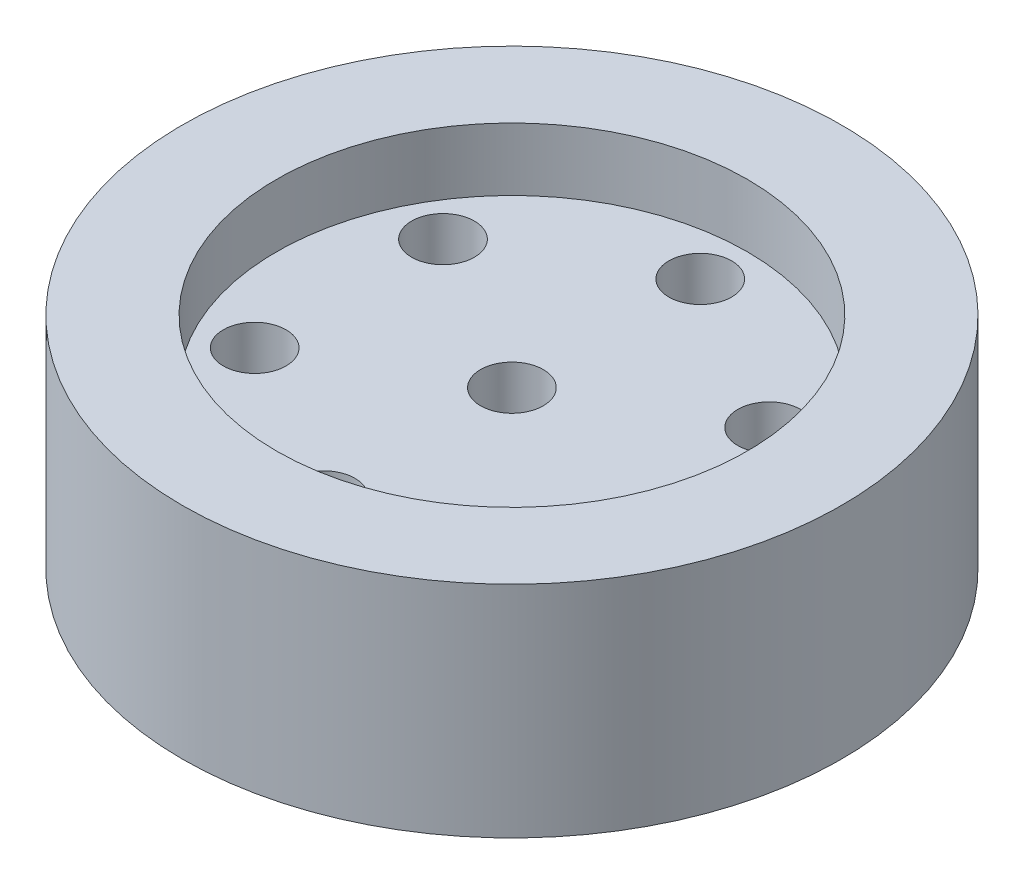
from build123d import *

# Parameters (mm, degrees)
SKETCH1_R               = 21
BOSS_EXTRUDE1_DEPTH     = 7
SKETCH2_R               = 15
CUT_EXTRUDE1_DEPTH      = 4
SKETCH3_R               = 19
SKETCH3_R_2             = 5
CUT_EXTRUDE2_DEPTH      = 4
SKETCH4_R               = 2
CUT_EXTRUDE3_DEPTH      = 33.832910319
CUT_EXTRUDE4_DEPTH      = 7
CUT_EXTRUDE4_DEPTH_BACK = 29
SKETCH5_R               = 2


with BuildPart() as part:
    # Sketch1 → Boss-Extrude1 (new, symmetric)
    with BuildSketch(Plane(origin=(0, 0, 0), x_dir=(1, 0, 0), z_dir=(0, 1, 0))):
        with Locations(Location((0, 0, 0), (0, 0, 270))):
            Circle(SKETCH1_R)
    extrude(amount=BOSS_EXTRUDE1_DEPTH, both=True)

    # Sketch2 → Cut-Extrude1 (cut)
    with BuildSketch(Plane(origin=(0, 7, 0), x_dir=(1, 0, 0), z_dir=(0, 1, 0))):
        with Locations(Location((0, 0, 0), (0, 0, 270))):
            Circle(SKETCH2_R)
    extrude(amount=-CUT_EXTRUDE1_DEPTH, mode=Mode.SUBTRACT)

    # Sketch3 → Cut-Extrude2 (cut)
    with BuildSketch(Plane.XZ.offset(7)):
        with Locations(Location((0, 0, 0), (0, 0, 270))):
            Circle(SKETCH3_R)
        with Locations(Location((0, 0, 0), (0, 0, 270))):
            Circle(SKETCH3_R_2, mode=Mode.SUBTRACT)
    extrude(amount=-CUT_EXTRUDE2_DEPTH, mode=Mode.SUBTRACT)

    # Sketch4 → Cut-Extrude3 (cut, through all)
    with BuildSketch(Plane.XZ.offset(7)):
        with Locations(Location((0, 0, 0), (0, 0, 270))):
            Circle(SKETCH4_R)
    extrude(amount=-CUT_EXTRUDE3_DEPTH, mode=Mode.SUBTRACT)

    # Sketch5 → Cut-Extrude4 (cut, two sides: drawn at the far end of the back side and taken through both)
    with BuildSketch(Plane.XZ.offset(3).offset(-CUT_EXTRUDE4_DEPTH_BACK)):
        with Locations(Location((0, 12, 0), (0, 0, 270))):
            Circle(SKETCH5_R)
        with Locations(Location((10.392304845, 6, 0), (0, 0, 270))):
            Circle(SKETCH5_R)
        with Locations(Location((10.392304845, -6, 0), (0, 0, 270))):
            Circle(SKETCH5_R)
        with Locations(Location((0, -12, 0), (0, 0, 270))):
            Circle(SKETCH5_R)
        with Locations(Location((-10.392304845, -6, 0), (0, 0, 270))):
            Circle(SKETCH5_R)
        with Locations(Location((-10.392304845, 6, 0), (0, 0, 270))):
            Circle(SKETCH5_R)
    extrude(amount=CUT_EXTRUDE4_DEPTH + CUT_EXTRUDE4_DEPTH_BACK, mode=Mode.SUBTRACT)


solid = part.part
